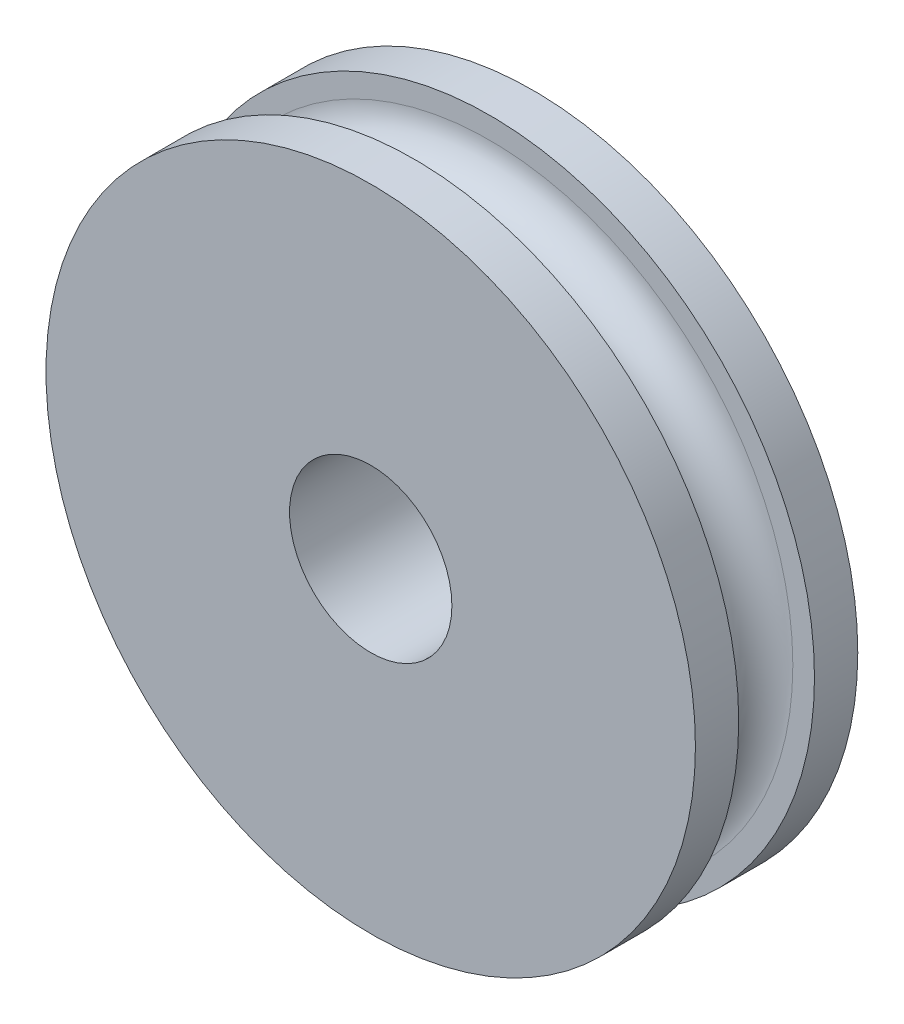
from build123d import *


with BuildPart() as part:
    # Sketch1 → Revolve1 (revolve)
    with BuildSketch(Plane(origin=(0, 0, 0), x_dir=(0, 0, -1), z_dir=(1, 0, 0)), mode=Mode.PRIVATE) as revolve1_sk:
        with BuildLine():
            ThreePointArc((0.7, 5.6), (0, 4.9), (-0.7, 5.6))
            Line((-0.7, 5.6), (-0.7, 6))
            Line((-0.7, 6), (-1.5, 6))
            Line((-1.5, 6), (-1.5, 1.5))
            Line((-1.5, 1.5), (1.5, 1.5))
            Line((1.5, 1.5), (1.5, 6))
            Line((1.5, 6), (0.7, 6))
            Line((0.7, 6), (0.7, 5.6))
        make_face()
    revolve(revolve1_sk.sketch.rotate(Axis((0, 0, 1.5), (0, 0, -1)), 90), axis=Axis((0, 0, 1.5), (0, 0, -1)))


solid = part.part
